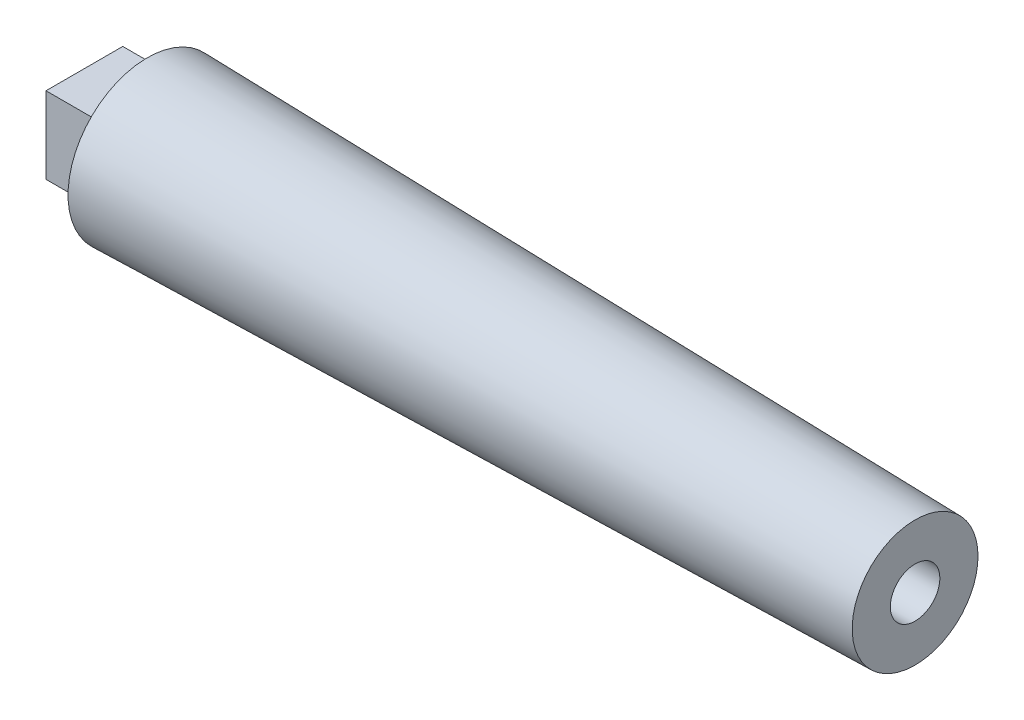
from build123d import *

# Parameters (mm, degrees)
SKETCH2_W           = 15.5
SKETCH2_H           = 15.5
BOSS_EXTRUDE1_DEPTH = 12.7
SKETCH3_R           = 5
CUT_EXTRUDE1_DEPTH  = 26


with BuildPart() as part:
    # Sketch1 → Revolve1 (revolve)
    with BuildSketch(Plane.XY, mode=Mode.PRIVATE) as revolve1_sk:
        Polygon((0, 0), (0, 16), (155, 12.7), (155, 0), align=None)
    revolve(revolve1_sk.sketch.rotate(Axis((155, 0, 0), (-1, 0, 0)), 90), axis=Axis((155, 0, 0), (-1, 0, 0)))

    # Sketch2 → Boss-Extrude1 (add)
    with BuildSketch(Plane.ZY):
        Rectangle(SKETCH2_W, SKETCH2_H)
    extrude(amount=BOSS_EXTRUDE1_DEPTH)

    # Sketch3 → Cut-Extrude1 (cut)
    with BuildSketch(Plane(origin=(155, 0, 0), x_dir=(0, 0, -1), z_dir=(1, 0, 0))):
        Circle(SKETCH3_R)
    extrude(amount=-CUT_EXTRUDE1_DEPTH, mode=Mode.SUBTRACT)


solid = part.part
